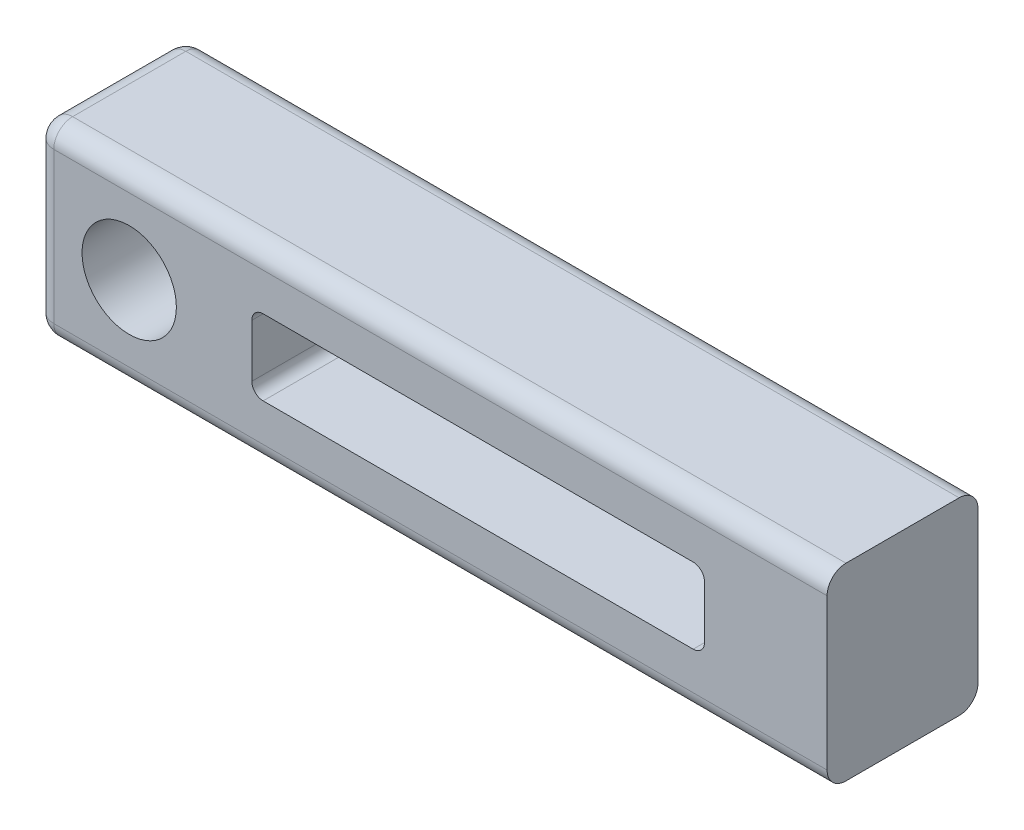
from build123d import *

# Parameters (mm, degrees)
CROQUIS1_W              = 210
CROQUIS1_H              = 50
CROQUIS1_R              = 12.5
SALIENTE_EXTRUIR1_DEPTH = 40
REDONDEO1_R             = 5
CORTAR_EXTRUIR1_DEPTH   = 191.91883092


with BuildPart() as part:
    # Croquis1 → Saliente-Extruir1 (new body)
    with BuildSketch(Plane.XY):
        with Locations((80, 0)):
            Rectangle(CROQUIS1_W, CROQUIS1_H)
        Circle(CROQUIS1_R, mode=Mode.SUBTRACT)
    extrude(amount=SALIENTE_EXTRUIR1_DEPTH)

    # Redondeo1
    redondeo1_edges = [part.edges().sort_by_distance(p)[0] for p in [
        (80, 25, 40),
        (-25, 0, 40),
        (80, -25, 40),
        (-25, 0, 0),
        (80, 25, 0),
        (80, -25, 0),
        (-25, -25, 20),
        (-25, 25, 20),
    ]]
    fillet(redondeo1_edges, radius=REDONDEO1_R)

    # Croquis2 → Cortar-Extruir1 (cut, through all)
    with BuildSketch(Plane.XY.offset(40)):
        with BuildLine():
            Line((149.499217678, 10), (35.500782322, 10))
            ThreePointArc((35.500782322, 10), (33.379461979, 9.121320344), (32.500782322, 7))
            Line((32.500782322, 7), (32.500782322, -7))
            ThreePointArc((32.500782322, -7), (33.379461979, -9.121320344), (35.500782322, -10))
            Line((35.500782322, -10), (149.499217678, -10))
            ThreePointArc((149.499217678, -10), (151.620538021, -9.121320344), (152.499217678, -7))
            Line((152.499217678, -7), (152.499217678, 7))
            ThreePointArc((152.499217678, 7), (151.620538021, 9.121320344), (149.499217678, 10))
        make_face()
    extrude(amount=-CORTAR_EXTRUIR1_DEPTH, mode=Mode.SUBTRACT)


solid = part.part
